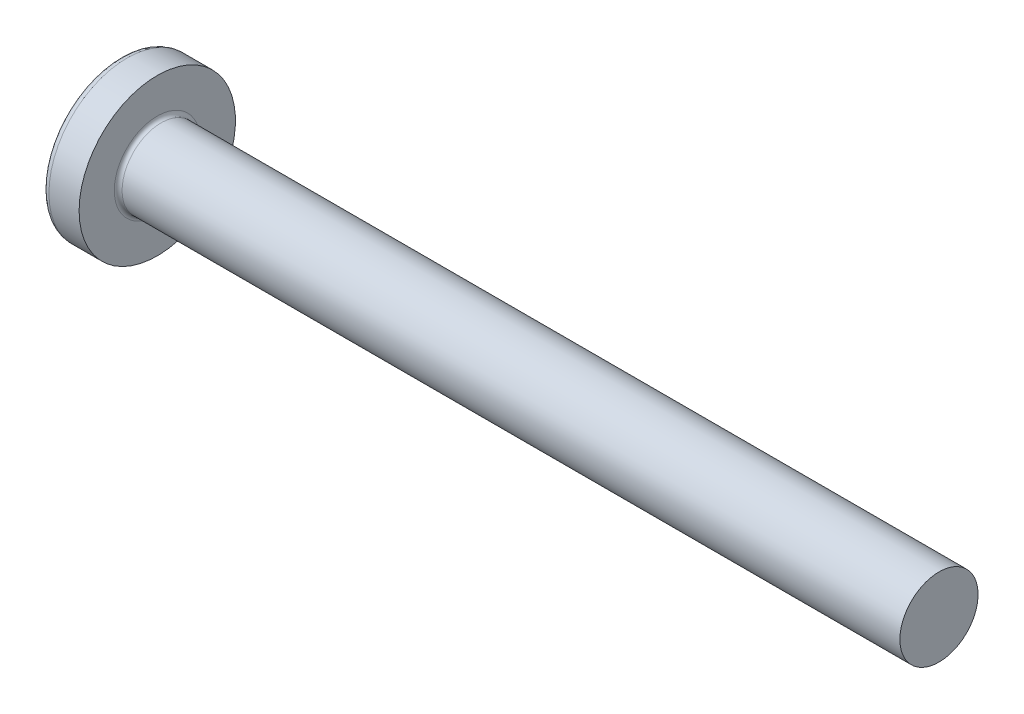
from build123d import *

# Parameters (mm, degrees)
FILLET1_R    = 0.2
RECPAT_COUNT = 2
RECPAT_ANGLE = 90


with BuildPart() as part:
    # BodySke → Base-Revolve (revolve)
    with BuildSketch(Plane.XY, mode=Mode.PRIVATE) as base_revolve_sk:
        with BuildLine():
            Line((3.1, 2), (3.1, 4))
            Line((3.1, 4), (1.555305874, 4))
            ThreePointArc((1.555305874, 4), (1.392873227, 3.961271902), (1.265388955, 3.853420195))
            ThreePointArc((1.265388955, 3.853420195), (0.324444487, 2.027933456), (0, 0))
            Line((0, 0), (43.1, 0))
            Line((43.1, 0), (43.1, 2))
            Line((43.1, 2), (3.1, 2))
        make_face()
    revolve(base_revolve_sk.sketch.rotate(Axis((1.555305874, 0, 0), (1, 0, 0)), 90), axis=Axis((1.555305874, 0, 0), (1, 0, 0)))

    # Fillet1
    fillet1_edges = [part.edges().sort_by_distance(p)[0] for p in [
        (3.1, 0, -2),
    ]]
    fillet(fillet1_edges, radius=FILLET1_R)

    # Sketch3 → Recess section 0
    with BuildSketch(Plane(origin=(0, 0, 0), x_dir=(0, 0, -1), z_dir=(1, 0, 0))):
        with BuildLine():
            Line((0.515, -2.15), (-0.515, -2.15))
            Line((-0.515, -2.15), (-0.515, 2.15))
            Line((-0.515, 2.15), (0.515, 2.15))
            Line((0.515, 2.15), (0.515, -2.15))
        make_face()
    # Sketch4 → Recess section 1
    with BuildSketch(Plane(origin=(2.34, 0, 0), x_dir=(0, 0, -1), z_dir=(1, 0, 0))):
        with BuildLine():
            Line((0.515, -0.983319232), (-0.515, -0.983319232))
            Line((-0.515, -0.983319232), (-0.515, 0.983319232))
            Line((-0.515, 0.983319232), (0.515, 0.983319232))
            Line((0.515, 0.983319232), (0.515, -0.983319232))
        make_face()
    recess = loft(mode=Mode.SUBTRACT)

    # RecPat: Recess ×2 about axis
    recpat_axis = Axis((0, 0, 0), (1, 0, 0))
    for i in range(1, RECPAT_COUNT):
        add(recess.rotate(recpat_axis, i * RECPAT_ANGLE / (RECPAT_COUNT - 1)), mode=Mode.SUBTRACT)

    # RecCorSke → RecessCore (revolve, cut)
    with BuildSketch(Plane.XY, mode=Mode.PRIVATE) as recesscore_sk:
        Polygon((0, 0), (0, 1.01462874), (2.34, 0.851), (2.616506661, 0), align=None)
    revolve(recesscore_sk.sketch.rotate(Axis((-3.175, 0, 0), (1, 0, 0)), 345.452408241), axis=Axis((-3.175, 0, 0), (1, 0, 0)), mode=Mode.SUBTRACT)


solid = part.part
